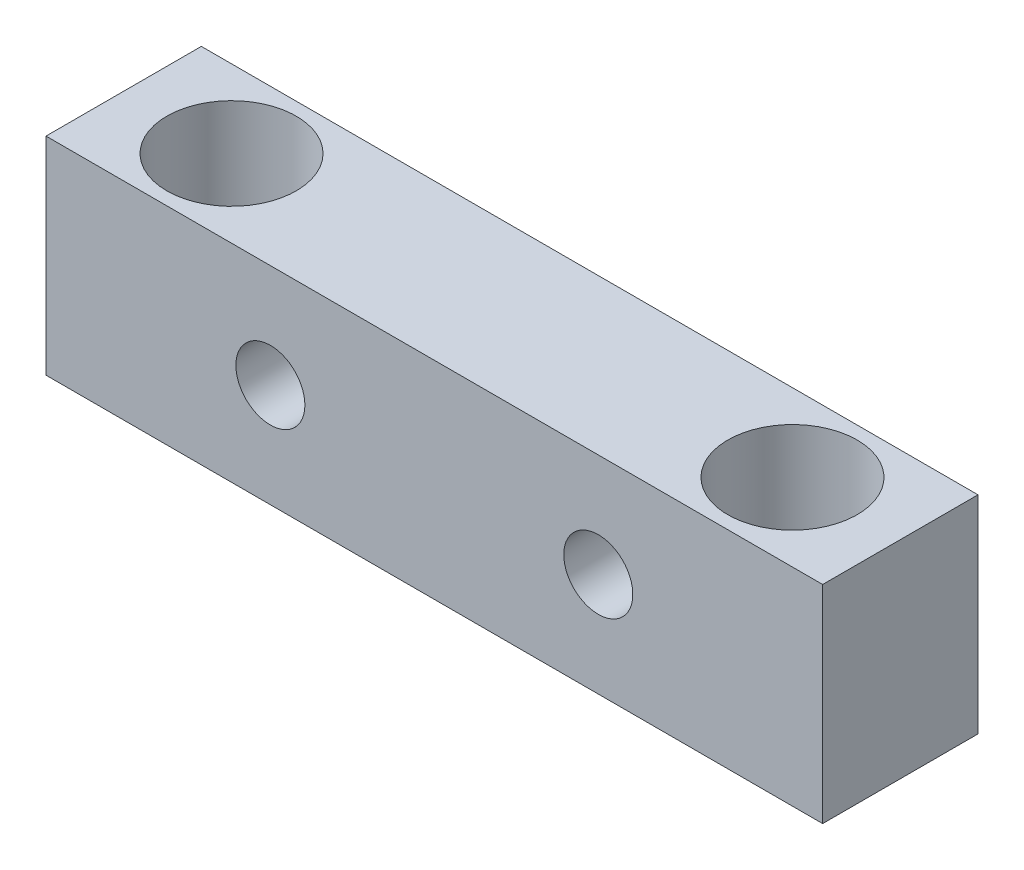
from build123d import *

# Parameters (mm, degrees)
SKETCH1_W           = 90
SKETCH1_H           = 24
SKETCH1_R           = 4
BOSS_EXTRUDE1_DEPTH = 18
SKETCH2_R           = 7.5
CUT_EXTRUDE3_DEPTH  = 55.083269132


with BuildPart() as part:
    # Sketch1 → Boss-Extrude1 (new body)
    with BuildSketch(Plane.XY):
        Rectangle(SKETCH1_W, SKETCH1_H)
        with Locations((-19, 0)):
            Circle(SKETCH1_R, mode=Mode.SUBTRACT)
        with Locations(Location((19, 0, 0), (0, 0, 180))):
            Circle(SKETCH1_R, mode=Mode.SUBTRACT)
    extrude(amount=BOSS_EXTRUDE1_DEPTH)

    # Sketch2 → Cut-Extrude3 (cut, through all)
    with BuildSketch(Plane(origin=(0, 12, 0), x_dir=(1, 0, 0), z_dir=(0, 1, 0))):
        with Locations(Location((-32.5, -9, 0), (0, 0, 270))):
            Circle(SKETCH2_R)
        with Locations(Location((32.5, -9, 0), (0, 0, 90))):
            Circle(SKETCH2_R)
    extrude(amount=-CUT_EXTRUDE3_DEPTH, mode=Mode.SUBTRACT)


solid = part.part
